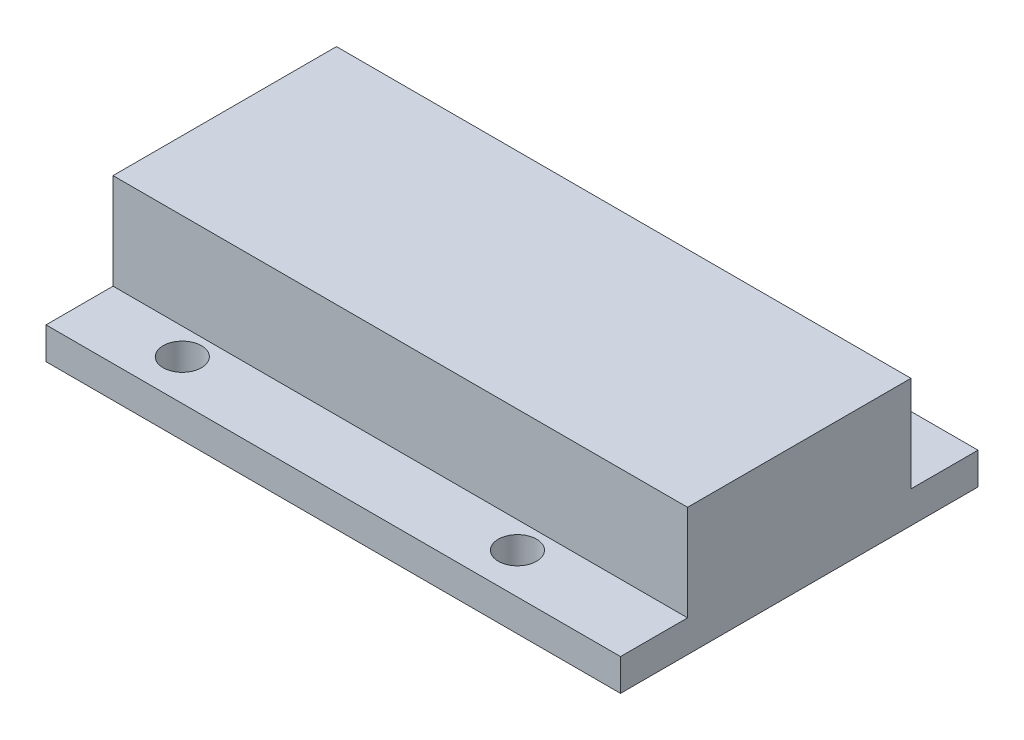
from build123d import *

# Parameters (mm, degrees)
EXTRUDE_1_DEPTH     = 18
EXTRUDE_2_DEPTH     = 5
EXTRUDE_3_DEPTH     = 1
SKETCH_2_R          = 0.6
CUT_EXTRUDE_1_DEPTH = 20.270703153


with BuildPart() as part:
    # 草图1 → 凸台-拉伸1 (new body)
    with BuildSketch(Plane(origin=(0, 0, 0), x_dir=(0, 0, -1), z_dir=(1, 0, 0))):
        with BuildLine():
            Line((-5.6, 1), (-5.6, 0))
            Line((-5.6, 0), (-3.1, 0))
            ThreePointArc((-3.1, 0), (0, 3.1), (3.1, 0))
            Line((3.1, 0), (5.6, 0))
            Line((5.6, 0), (5.6, 1))
            Line((5.6, 1), (3.5, 1))
            Line((3.5, 1), (3.5, 4))
            Line((3.5, 4), (-3.5, 4))
            Line((-3.5, 4), (-3.5, 1))
            Line((-3.5, 1), (-5.6, 1))
        make_face()
    extrude(amount=-EXTRUDE_1_DEPTH)

    # 草图1<6> → 凸台-拉伸2 (add)
    with BuildSketch(Plane(origin=(0, 0, 0), x_dir=(0, 0, -1), z_dir=(1, 0, 0))):
        with BuildLine():
            ThreePointArc((3.1, 0), (0, 3.1), (-3.1, 0))
            Line((-3.1, 0), (-1.5, 0))
            ThreePointArc((-1.5, 0), (0, 1.5), (1.5, 0))
            Line((1.5, 0), (3.1, 0))
        make_face()
    extrude(amount=-EXTRUDE_2_DEPTH)

    # 草图1<7> → 凸台-拉伸3 (add)
    with BuildSketch(Plane(origin=(0, 0, 0), x_dir=(0, 0, -1), z_dir=(1, 0, 0))):
        with BuildLine():
            ThreePointArc((1.5, 0), (0, 1.5), (-1.5, 0))
            Line((-1.5, 0), (1.5, 0))
        make_face()
    extrude(amount=-EXTRUDE_3_DEPTH)

    # 草图2 → 切除-拉伸1 (cut, through all)
    with BuildSketch(Plane.XZ):
        with Locations((-15, 4.329534947)):
            Circle(SKETCH_2_R)
        with Locations((-4.5, 4.329534947)):
            Circle(SKETCH_2_R)
        with Locations((-9, -4.420465053)):
            Circle(SKETCH_2_R)
    extrude(amount=-CUT_EXTRUDE_1_DEPTH, mode=Mode.SUBTRACT)


solid = part.part
